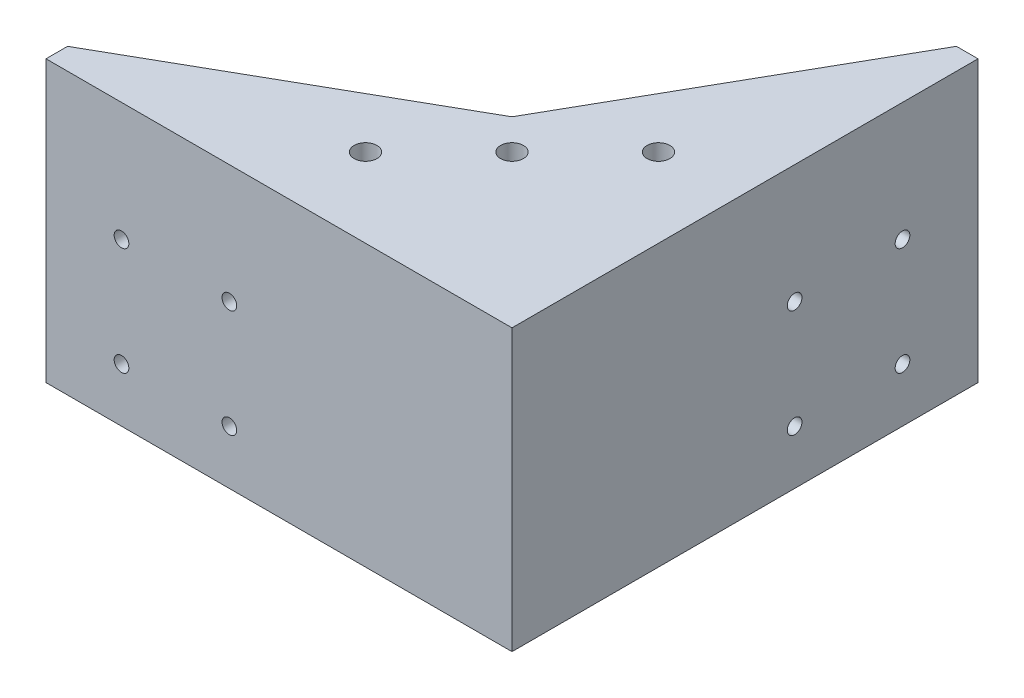
from build123d import *

# Parameters (mm, degrees)
EXTRUDE_2_DEPTH     = 60
SKETCH_4_R          = 1.7
CUT_EXTRUDE_1_DEPTH = 131.862523283
SKETCH_5_R          = 1.7
CUT_EXTRUDE_2_DEPTH = 131.862523283
SKETCH_6_R          = 2.65
EXTRUDE_4_DEPTH     = 5
RIB_1_REACH         = 110.467
RIB_4_REACH         = 110.467
SKETCH_13_WALL_W    = 247.21744068
SKETCH_13_WALL_H    = 35


with BuildPart() as part:
    # 草图3 → 凸台-拉伸2 (new body)
    with BuildSketch(Plane(origin=(0, 0, 0), x_dir=(1, 0, 0), z_dir=(0, 1, 0))):
        Polygon((54, 54), (49, 54), (49, -49), (-54, -49), (-54, -54), (54, -54), align=None)
    extrude(amount=EXTRUDE_2_DEPTH)

    # 草图4 → 切除-拉伸1 (cut, through all)
    with BuildSketch(Plane(origin=(0, 0, 49), x_dir=(-1, 0, 0), z_dir=(0, 0, -1))):
        with Locations((36.5, 37.5)):
            Circle(SKETCH_4_R)
        with Locations(Location((36.5, 12.5, 0), (0, 0, 180))):
            Circle(SKETCH_4_R)
        with Locations((11.5, 12.5)):
            Circle(SKETCH_4_R)
        with Locations(Location((11.5, 37.5, 0), (0, 0, 180))):
            Circle(SKETCH_4_R)
    extrude(amount=-CUT_EXTRUDE_1_DEPTH, mode=Mode.SUBTRACT)

    # 草图5 → 切除-拉伸2 (cut, through all)
    with BuildSketch(Plane.ZY.offset(-49)):
        with Locations((-36.5, 37.5)):
            Circle(SKETCH_5_R)
        with Locations(Location((-36.5, 12.5, 0), (0, 0, 180))):
            Circle(SKETCH_5_R)
        with Locations((-11.5, 12.5)):
            Circle(SKETCH_5_R)
        with Locations(Location((-11.5, 37.5, 0), (0, 0, 180))):
            Circle(SKETCH_5_R)
    extrude(amount=-CUT_EXTRUDE_2_DEPTH, mode=Mode.SUBTRACT)

    # 草图6 → 凸台-拉伸4 (add)
    with BuildSketch(Plane(origin=(0, 60, 0), x_dir=(1, 0, 0), z_dir=(0, 1, 0))):
        Polygon((-54, -49), (-54, -54), (54, -54), (54, 54), (49, 54), (11.642135624, -11.642135624), align=None)
        with Locations(Location((1.742640687, -35.683766184, 0), (0, 0, 270))):
            Circle(SKETCH_6_R, mode=Mode.SUBTRACT)
        with Locations(Location((35.683766184, -1.742640687, 0), (0, 0, 90))):
            Circle(SKETCH_6_R, mode=Mode.SUBTRACT)
        with Locations(Location((18.713203436, -18.713203436, 0), (0, 0, 270))):
            Circle(SKETCH_6_R, mode=Mode.SUBTRACT)
    extrude(amount=EXTRUDE_4_DEPTH)

    # 草图10 walls → 筋1 (add, up to next)
    with BuildSketch(Plane(origin=(0, 0, 14), x_dir=(-1, 0, 0), z_dir=(0, 0, -1)), mode=Mode.PRIVATE) as rib_1_sk1:
        Polygon((18.817089986, 163.891167178), (-149.296374034, -16.112124581), (-123.717265916, -40.00164588), (44.396198104, 140.00164588), align=None)
    rib_1_tool1 = extrude(rib_1_sk1.sketch, amount=-RIB_1_REACH, mode=Mode.PRIVATE) - part.part
    add(rib_1_tool1.solids().sort_by_distance((39.660533906, 50, 14))[0])

    # 草图13 wall → 筋4 (add, up to next)
    with BuildSketch(Plane(origin=(14, 50, 39), x_dir=(0, -0.707106781187, 0.707106781187), z_dir=(0, 0.707106781187, 0.707106781187)), mode=Mode.PRIVATE) as rib_4_sk1:
        with Locations((0, 17.5)):
            Rectangle(SKETCH_13_WALL_W, SKETCH_13_WALL_H)
    rib_4_tool1 = extrude(rib_4_sk1.sketch, amount=RIB_4_REACH, mode=Mode.PRIVATE) - part.part
    add(rib_4_tool1.solids().sort_by_distance((14, 50, 39))[0])


solid = part.part
